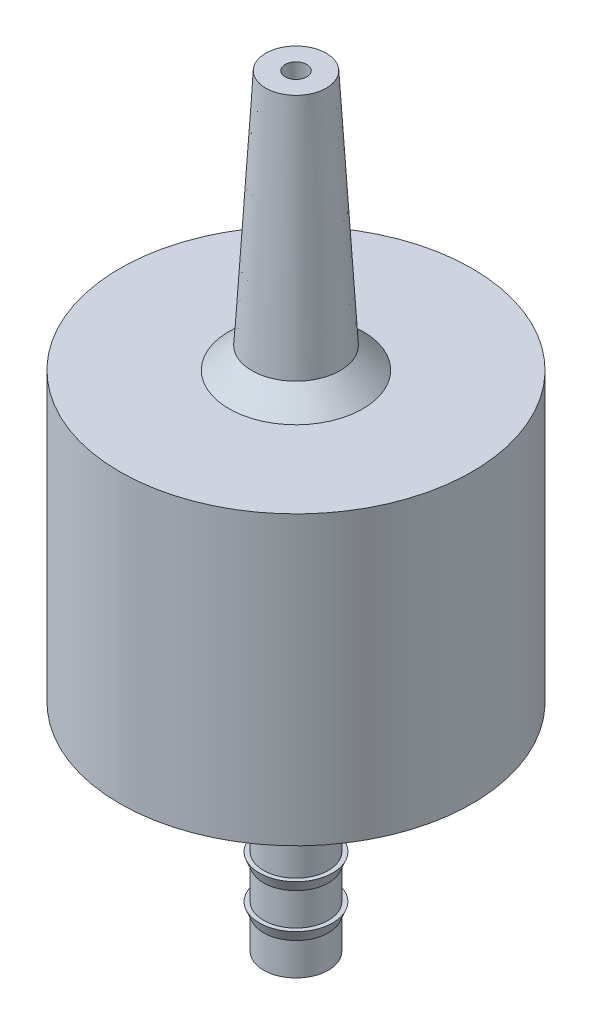
from build123d import *


with BuildPart() as part:
    # Esboço1 → Revolução1 (revolve)
    with BuildSketch(Plane.XY, mode=Mode.PRIVATE) as revolu_o1_sk:
        Polygon((2.1, 0), (8.15, 0), (8.15, -13.3), (1.5, -13.3), (1.5, -15.3), (1.7, -15.3), (1.5, -15.8), (1.5, -17.3), (1.7, -17.3), (1.5, -17.8), (1.5, -19.3), (1.7, -19.3), (1.5, -19.8), (1.5, -21.3), (1.7, -21.3), (1.5, -21.8), (1.5, -23.3), (1, -23.3), (1.25, 0), (0.5, 12), (1.4, 12), align=None)
    revolve(revolu_o1_sk.sketch.rotate(Axis((0, 23.058079528, 0), (0, -1, 0)), 90), axis=Axis((0, 23.058079528, 0), (0, -1, 0)))

    # Esboço2 → Revolução2 (revolve)
    with BuildSketch(Plane.XY, mode=Mode.PRIVATE) as revolu_o2_sk:
        Polygon((1.5, -14.8), (2.5, -13.3), (1.5, -13.3), align=None)
        Polygon((2.1, 0), (2.041765662, 0.998302941), (3.1, 0), align=None)
    revolve(revolu_o2_sk.sketch.rotate(Axis((0, 0.658037097, 0), (0, -1, 0)), 270), axis=Axis((0, 0.658037097, 0), (0, -1, 0)))


solid = part.part
